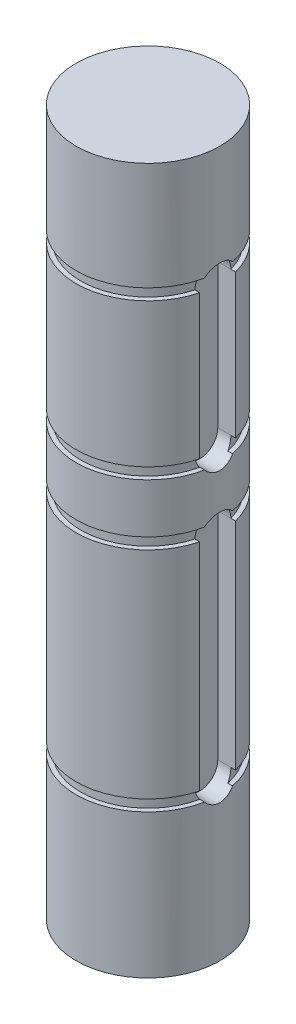
from build123d import *

# Parameters (mm, degrees)
SKETCH1_R           = 2.5
BOSS_EXTRUDE1_DEPTH = 24.53
SKETCH2_W           = 6.286937847
SKETCH2_H           = 0.39
SKETCH3_W           = 14.618328755
SKETCH3_H           = 0.39
SKETCH4_W           = 10.162341799
SKETCH4_H           = 0.39
SKETCH5_W           = 11.169222651
SKETCH5_H           = 0.39
CUT_EXTRUDE1_DEPTH  = 0.7
CUT_EXTRUDE2_DEPTH  = 0.7


with BuildPart() as part:
    # Sketch1 → Boss-Extrude1 (new body)
    with BuildSketch(Plane(origin=(0, 0, 0), x_dir=(1, 0, 0), z_dir=(0, 1, 0))):
        with Locations(Location((0, 0, 0), (0, 0, 270))):
            Circle(SKETCH1_R)
    extrude(amount=BOSS_EXTRUDE1_DEPTH)

    # Sketch2 → Cut-Revolve2 (revolve, cut)
    with BuildSketch(Plane(origin=(0, 0, 0), x_dir=(0, 0, -1), z_dir=(1, 0, 0))):
        with Locations((-5.483468924, 20.585)):
            Rectangle(SKETCH2_W, SKETCH2_H)
    revolve(axis=Axis((0, 23.104104934, 0), (0, -1, 0)), mode=Mode.SUBTRACT)

    # Sketch3 → Cut-Revolve3 (revolve, cut)
    with BuildSketch(Plane(origin=(0, 0, 0), x_dir=(0, 0, -1), z_dir=(1, 0, 0)), mode=Mode.PRIVATE) as cut_revolve3_sk:
        with Locations((-9.649164378, 15.195)):
            Rectangle(SKETCH3_W, SKETCH3_H)
    revolve(cut_revolve3_sk.sketch.rotate(Axis((0, 18.594919624, 0), (0, -1, 0)), 180), axis=Axis((0, 18.594919624, 0), (0, -1, 0)), mode=Mode.SUBTRACT)

    # Sketch4 → Cut-Revolve4 (revolve, cut)
    with BuildSketch(Plane(origin=(0, 0, 0), x_dir=(0, 0, -1), z_dir=(1, 0, 0)), mode=Mode.PRIVATE) as cut_revolve4_sk:
        with Locations((-7.4211709, 13.085)):
            Rectangle(SKETCH4_W, SKETCH4_H)
    revolve(cut_revolve4_sk.sketch.rotate(Axis((0, 14.558913737, 0), (0, -1, 0)), 180), axis=Axis((0, 14.558913737, 0), (0, -1, 0)), mode=Mode.SUBTRACT)

    # Sketch5 → Cut-Revolve5 (revolve, cut)
    with BuildSketch(Plane(origin=(0, 0, 0), x_dir=(0, 0, -1), z_dir=(1, 0, 0)), mode=Mode.PRIVATE) as cut_revolve5_sk:
        with Locations((-7.924611325, 5.195)):
            Rectangle(SKETCH5_W, SKETCH5_H)
    revolve(cut_revolve5_sk.sketch.rotate(Axis((0, 6.264518199, 0), (0, -1, 0)), 180), axis=Axis((0, 6.264518199, 0), (0, -1, 0)), mode=Mode.SUBTRACT)

    # Sketch6 → Cut-Extrude1 (cut)
    with BuildSketch(Plane(origin=(2.5, 0, 0), x_dir=(0, 0, -1), z_dir=(1, 0, 0))):
        with BuildLine():
            Line((0.625, 20.39), (0.625, 15.39))
            ThreePointArc((0.625, 15.39), (0, 14.765), (-0.625, 15.39))
            Line((-0.625, 15.39), (-0.625, 20.39))
            ThreePointArc((-0.625, 20.39), (0, 21.015), (0.625, 20.39))
        make_face()
    extrude(amount=-CUT_EXTRUDE1_DEPTH, mode=Mode.SUBTRACT)

    # Sketch7 → Cut-Extrude2 (cut)
    with BuildSketch(Plane(origin=(2.5, 0, 0), x_dir=(0, 0, -1), z_dir=(1, 0, 0))):
        with BuildLine():
            Line((0.625, 12.89), (0.625, 5.39))
            ThreePointArc((0.625, 5.39), (0, 4.765), (-0.625, 5.39))
            Line((-0.625, 5.39), (-0.625, 12.89))
            ThreePointArc((-0.625, 12.89), (0, 13.515), (0.625, 12.89))
        make_face()
    extrude(amount=-CUT_EXTRUDE2_DEPTH, mode=Mode.SUBTRACT)


solid = part.part
